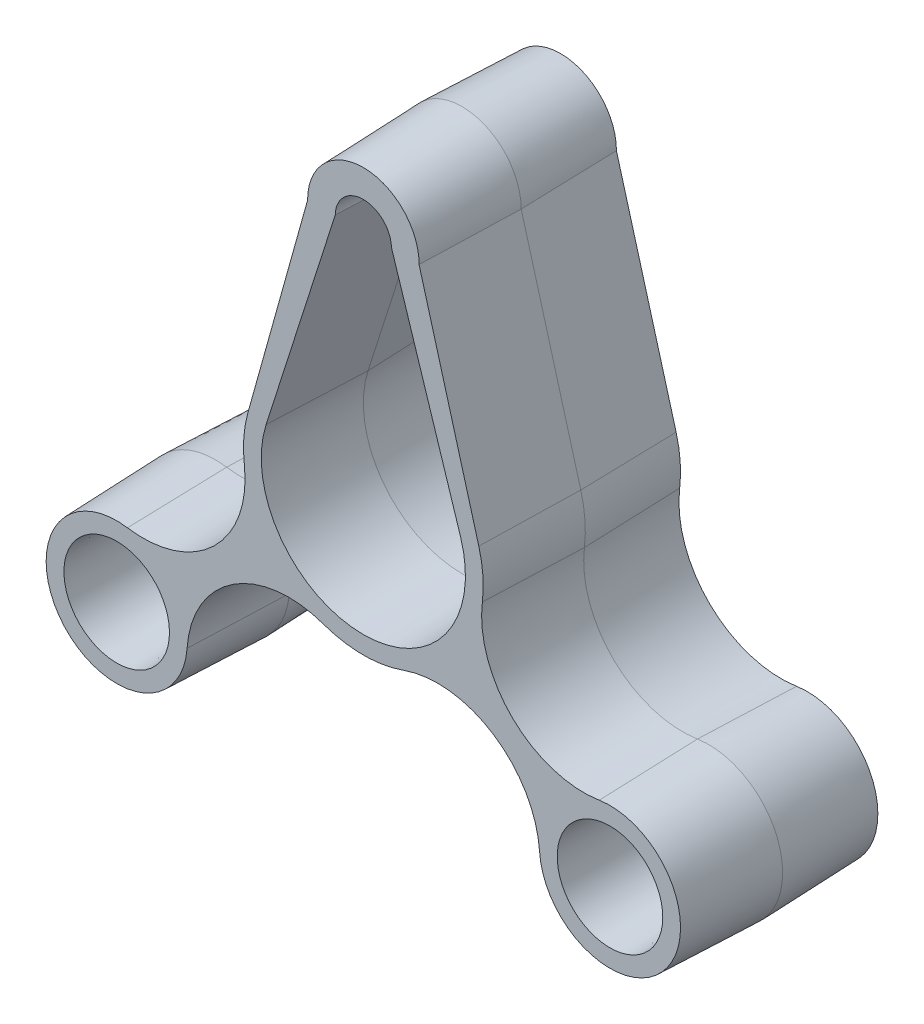
from build123d import *

# Parameters (mm, degrees)
SKETCH1_R                     = 10
BOSS_EXTRUDE1_DEPTH           = 20
BOSS_EXTRUDE1_DRAFT           = 2
BOSS_EXTRUDE1_OTHER_WAY_DEPTH = 20
BOSS_EXTRUDE1_OTHER_WAY_DRAFT = -2


with BuildPart() as part:
    # Sketch1 → Boss-Extrude1 (with draft: the straight prism first)
    with BuildSketch(Plane.XY):
        with BuildLine():
            Line((-12, 50), (-24.079653875, 6.72088307))
            ThreePointArc((-24.079653875, 6.72088307), (-24.928097247, 1.894721), (-24.81883517, -3.004233816))
            ThreePointArc((-24.81883517, -3.004233816), (-30.762049538, -19.776348187), (-47.717387131, -25.174694658))
            ThreePointArc((-47.717387131, -25.174694658), (-61.713032142, -49.370425713), (-35.03522611, -41.027395935))
            ThreePointArc((-35.03522611, -41.027395935), (-26.046643252, -25.670606045), (-8.378996809, -23.554031767))
            ThreePointArc((-8.378996809, -23.554031767), (0, -25), (8.378996809, -23.554031767))
            ThreePointArc((8.378996809, -23.554031767), (26.046643252, -25.670606045), (35.03522611, -41.027395935))
            ThreePointArc((35.03522611, -41.027395935), (61.713032142, -49.370425713), (47.717387131, -25.174694658))
            ThreePointArc((47.717387131, -25.174694658), (30.762049538, -19.776348187), (24.81883517, -3.004233816))
            ThreePointArc((24.81883517, -3.004233816), (24.928097247, 1.894721), (24.079653875, 6.72088307))
            Line((24.079653875, 6.72088307), (12, 50))
            ThreePointArc((12, 50), (0, 62), (-12, 50))
        make_face()
        with Locations((50, -40)):
            Circle(SKETCH1_R, mode=Mode.SUBTRACT)
        with Locations((-50, -40)):
            Circle(SKETCH1_R, mode=Mode.SUBTRACT)
        with BuildLine():
            ThreePointArc((5, 50), (0, 55), (-5, 50))
            Line((-5, 50), (-19.048602886, 6.095139711))
            ThreePointArc((-19.048602886, 6.095139711), (0, -20), (19.048602886, 6.095139711))
            Line((19.048602886, 6.095139711), (5, 50))
        make_face(mode=Mode.SUBTRACT)
    extrude(amount=BOSS_EXTRUDE1_DEPTH)
    # Boss-Extrude1: the draft: its side faces are tilted about the plane it starts from
    boss_extrude1_sides = [part.faces().sort_by_distance(p)[0] for p in [
        (24.928097247, 1.894721, 10),
        (18.039826938, 28.360441535, 10),
        (0, 62, 10),
        (-18.039826938, 28.360441535, 10),
        (-24.928097247, 1.894721, 10),
        (-30.762049538, -19.776348187, 10),
        (-61.713032142, -49.370425713, 10),
        (-26.046643252, -25.670606045, 10),
        (0, -25, 10),
        (26.046643252, -25.670606045, 10),
        (61.713032142, -49.370425713, 10),
        (30.762049538, -19.776348187, 10),
        (40, -40, 10),
        (-60, -40, 10),
        (0, -20, 10),
        (-12.024301443, 28.047569856, 10),
        (0, 55, 10),
        (12.024301443, 28.047569856, 10),
    ]]
    draft(boss_extrude1_sides, Plane.XY, BOSS_EXTRUDE1_DRAFT)


with BuildPart() as boss_extrude1_other_way_tool:
    # Sketch1 → Boss-Extrude1 other way (with draft: the straight prism first)
    with BuildSketch(Plane.XY):
        with BuildLine():
            Line((-12, 50), (-24.079653875, 6.72088307))
            ThreePointArc((-24.079653875, 6.72088307), (-24.928097247, 1.894721), (-24.81883517, -3.004233816))
            ThreePointArc((-24.81883517, -3.004233816), (-30.762049538, -19.776348187), (-47.717387131, -25.174694658))
            ThreePointArc((-47.717387131, -25.174694658), (-61.713032142, -49.370425713), (-35.03522611, -41.027395935))
            ThreePointArc((-35.03522611, -41.027395935), (-26.046643252, -25.670606045), (-8.378996809, -23.554031767))
            ThreePointArc((-8.378996809, -23.554031767), (0, -25), (8.378996809, -23.554031767))
            ThreePointArc((8.378996809, -23.554031767), (26.046643252, -25.670606045), (35.03522611, -41.027395935))
            ThreePointArc((35.03522611, -41.027395935), (61.713032142, -49.370425713), (47.717387131, -25.174694658))
            ThreePointArc((47.717387131, -25.174694658), (30.762049538, -19.776348187), (24.81883517, -3.004233816))
            ThreePointArc((24.81883517, -3.004233816), (24.928097247, 1.894721), (24.079653875, 6.72088307))
            Line((24.079653875, 6.72088307), (12, 50))
            ThreePointArc((12, 50), (0, 62), (-12, 50))
        make_face()
        with Locations((50, -40)):
            Circle(SKETCH1_R, mode=Mode.SUBTRACT)
        with Locations((-50, -40)):
            Circle(SKETCH1_R, mode=Mode.SUBTRACT)
        with BuildLine():
            ThreePointArc((5, 50), (0, 55), (-5, 50))
            Line((-5, 50), (-19.048602886, 6.095139711))
            ThreePointArc((-19.048602886, 6.095139711), (0, -20), (19.048602886, 6.095139711))
            Line((19.048602886, 6.095139711), (5, 50))
        make_face(mode=Mode.SUBTRACT)
    extrude(amount=-BOSS_EXTRUDE1_OTHER_WAY_DEPTH)
    # Boss-Extrude1 other way: the draft: its side faces are tilted about the plane it starts from
    boss_extrude1_other_way_sides = [boss_extrude1_other_way_tool.faces().sort_by_distance(p)[0] for p in [
        (24.928097247, 1.894721, -10),
        (18.039826938, 28.360441535, -10),
        (0, 62, -10),
        (-18.039826938, 28.360441535, -10),
        (-24.928097247, 1.894721, -10),
        (-30.762049538, -19.776348187, -10),
        (-61.713032142, -49.370425713, -10),
        (-26.046643252, -25.670606045, -10),
        (0, -25, -10),
        (26.046643252, -25.670606045, -10),
        (61.713032142, -49.370425713, -10),
        (30.762049538, -19.776348187, -10),
        (40, -40, -10),
        (-60, -40, -10),
        (0, -20, -10),
        (-12.024301443, 28.047569856, -10),
        (0, 55, -10),
        (12.024301443, 28.047569856, -10),
    ]]
    draft(boss_extrude1_other_way_sides, Plane.XY, BOSS_EXTRUDE1_OTHER_WAY_DRAFT)


with BuildPart() as part_1:
    add(part.part)

    # Boss-Extrude1 other way: add boss_extrude1_other_way_tool
    add(boss_extrude1_other_way_tool.part)


solid = part_1.part
